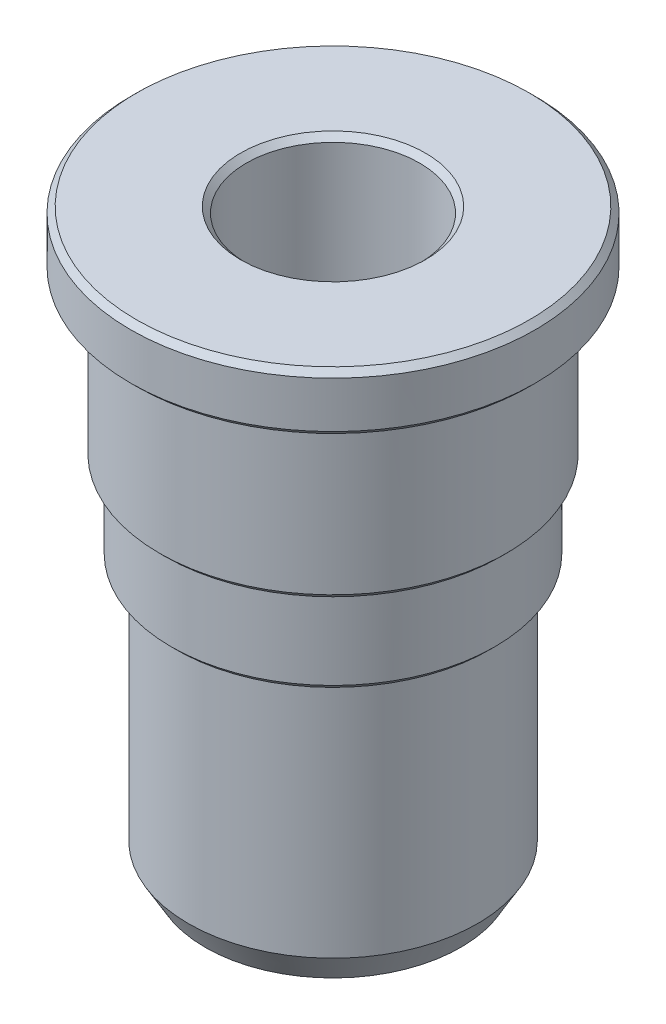
from build123d import *

# Parameters (mm, degrees)
SFAZOWANIE1_SIZE = 1


with BuildPart() as part:
    # Szkic1 → Obrót1 (revolve)
    with BuildSketch(Plane.XY, mode=Mode.PRIVATE) as obr_t1_sk:
        Polygon((-15, -70.098020295), (-15, 29.901979705), (-35, 29.901979705), (-35, 19.901979705), (-30, 19.901979705), (-30, -8.098020295), (-28, -8.098020295), (-28, -23.098020295), (-25, -23.098020295), (-25, -65.098020295), (-22.113248654, -70.098020295), align=None)
    revolve(obr_t1_sk.sketch.rotate(Axis((0, 34.945352564, 0), (0, -1, 0)), 270), axis=Axis((0, 34.945352564, 0), (0, -1, 0)))

    # Sfazowanie1
    sfazowanie1_edges = [part.edges().sort_by_distance(p)[0] for p in [
        (0, 19.901979705, -35),
        (0, 29.901979705, -35),
        (0, 29.901979705, -15),
        (0, -70.098020295, -15),
        (0, -23.098020295, -28),
        (0, -8.098020295, -30),
    ]]
    chamfer(sfazowanie1_edges, length=SFAZOWANIE1_SIZE)


solid = part.part
